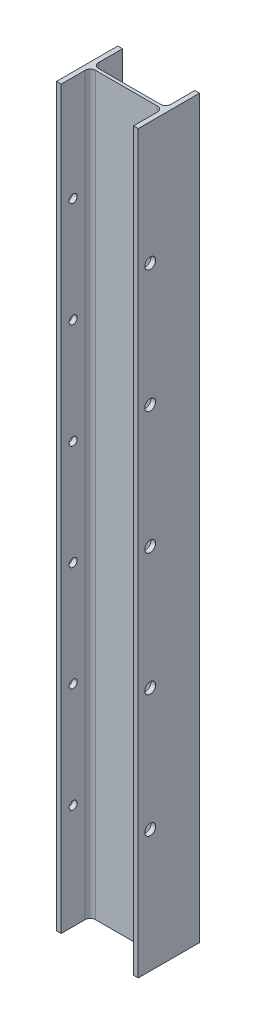
from build123d import *

# Parameters (mm, degrees)
AL_I_BEAM_AL_I_BEAM_4X2_31_4_DEPTH = 914.4
F_3_8_CLEARANCE_HOLE1_REACH        = 476.511
F_3_8_CLEARANCE_HOLE1_BORE_R       = 5.0419
F_1_2_CLEARANCE_HOLE1_D            = 13.49248
F_1_2_CLEARANCE_HOLE1_DEPTH        = 5.842


with BuildPart() as part:
    # Sketch11 → Al i beam AL I BEAM 4X2.31(4) (new body)
    with BuildSketch(Plane(origin=(53.975, -457.2, -38.1), x_dir=(0, 0, -1), z_dir=(0, 1, 0))):
        with BuildLine():
            Line((-38.1, -50.8), (-38.1, -44.958))
            Line((-38.1, -44.958), (-8.255, -44.958))
            ThreePointArc((-8.255, -44.958), (-3.764871939, -43.098128061), (-1.905, -38.608))
            Line((-1.905, -38.608), (-1.905, 38.608))
            ThreePointArc((-1.905, 38.608), (-3.764871939, 43.098128061), (-8.255, 44.958))
            Line((-8.255, 44.958), (-38.1, 44.958))
            Line((-38.1, 44.958), (-38.1, 50.8))
            Line((-38.1, 50.8), (38.1, 50.8))
            Line((38.1, 50.8), (38.1, 44.958))
            Line((38.1, 44.958), (8.255, 44.958))
            ThreePointArc((8.255, 44.958), (3.764871939, 43.098128061), (1.905, 38.608))
            Line((1.905, 38.608), (1.905, -38.608))
            ThreePointArc((1.905, -38.608), (3.764871939, -43.098128061), (8.255, -44.958))
            Line((8.255, -44.958), (38.1, -44.958))
            Line((38.1, -44.958), (38.1, -50.8))
            Line((38.1, -50.8), (-38.1, -50.8))
        make_face()
    extrude(amount=AL_I_BEAM_AL_I_BEAM_4X2_31_4_DEPTH)

    # 3/8 Clearance Hole1 bore → 3/8 Clearance Hole1 (cut, up to next)
    with BuildSketch(Plane(origin=(3.175, 0, 0), x_dir=(0, 0, -1), z_dir=(-1, 0, 0)), mode=Mode.PRIVATE) as f_3_8_clearance_hole1_sk1:
        with Locations((14.9225, -326.571428209)):
            Circle(F_3_8_CLEARANCE_HOLE1_BORE_R)
    f_3_8_clearance_hole1_tool1 = extrude(f_3_8_clearance_hole1_sk1.sketch, amount=-F_3_8_CLEARANCE_HOLE1_REACH, mode=Mode.PRIVATE) & part.part
    # 3/8 Clearance Hole1 bore → 3/8 Clearance Hole1 (cut, up to next)
    with BuildSketch(Plane(origin=(3.175, 0, 0), x_dir=(0, 0, -1), z_dir=(-1, 0, 0)), mode=Mode.PRIVATE) as f_3_8_clearance_hole1_sk2:
        with Locations((14.9225, 326.571428571)):
            Circle(F_3_8_CLEARANCE_HOLE1_BORE_R)
    f_3_8_clearance_hole1_tool2 = extrude(f_3_8_clearance_hole1_sk2.sketch, amount=-F_3_8_CLEARANCE_HOLE1_REACH, mode=Mode.PRIVATE) & part.part
    # 3/8 Clearance Hole1 bore → 3/8 Clearance Hole1 (cut, up to next)
    with BuildSketch(Plane(origin=(3.175, 0, 0), x_dir=(0, 0, -1), z_dir=(-1, 0, 0)), mode=Mode.PRIVATE) as f_3_8_clearance_hole1_sk3:
        with Locations((14.9225, 195.942857215)):
            Circle(F_3_8_CLEARANCE_HOLE1_BORE_R)
    f_3_8_clearance_hole1_tool3 = extrude(f_3_8_clearance_hole1_sk3.sketch, amount=-F_3_8_CLEARANCE_HOLE1_REACH, mode=Mode.PRIVATE) & part.part
    # 3/8 Clearance Hole1 bore → 3/8 Clearance Hole1 (cut, up to next)
    with BuildSketch(Plane(origin=(3.175, 0, 0), x_dir=(0, 0, -1), z_dir=(-1, 0, 0)), mode=Mode.PRIVATE) as f_3_8_clearance_hole1_sk4:
        with Locations((14.9225, 65.314285859)):
            Circle(F_3_8_CLEARANCE_HOLE1_BORE_R)
    f_3_8_clearance_hole1_tool4 = extrude(f_3_8_clearance_hole1_sk4.sketch, amount=-F_3_8_CLEARANCE_HOLE1_REACH, mode=Mode.PRIVATE) & part.part
    # 3/8 Clearance Hole1 bore → 3/8 Clearance Hole1 (cut, up to next)
    with BuildSketch(Plane(origin=(3.175, 0, 0), x_dir=(0, 0, -1), z_dir=(-1, 0, 0)), mode=Mode.PRIVATE) as f_3_8_clearance_hole1_sk5:
        with Locations((14.9225, -65.314285497)):
            Circle(F_3_8_CLEARANCE_HOLE1_BORE_R)
    f_3_8_clearance_hole1_tool5 = extrude(f_3_8_clearance_hole1_sk5.sketch, amount=-F_3_8_CLEARANCE_HOLE1_REACH, mode=Mode.PRIVATE) & part.part
    # 3/8 Clearance Hole1 bore → 3/8 Clearance Hole1 (cut, up to next)
    with BuildSketch(Plane(origin=(3.175, 0, 0), x_dir=(0, 0, -1), z_dir=(-1, 0, 0)), mode=Mode.PRIVATE) as f_3_8_clearance_hole1_sk6:
        with Locations((14.9225, -195.942856853)):
            Circle(F_3_8_CLEARANCE_HOLE1_BORE_R)
    f_3_8_clearance_hole1_tool6 = extrude(f_3_8_clearance_hole1_sk6.sketch, amount=-F_3_8_CLEARANCE_HOLE1_REACH, mode=Mode.PRIVATE) & part.part
    add(f_3_8_clearance_hole1_tool1.solids().sort_by_distance((3.175, 326.571428, -14.9225))[0], mode=Mode.SUBTRACT)
    add(f_3_8_clearance_hole1_tool2.solids().sort_by_distance((3.175, -326.571429, -14.9225))[0], mode=Mode.SUBTRACT)
    add(f_3_8_clearance_hole1_tool3.solids().sort_by_distance((3.175, -195.942857, -14.9225))[0], mode=Mode.SUBTRACT)
    add(f_3_8_clearance_hole1_tool4.solids().sort_by_distance((3.175, -65.314286, -14.9225))[0], mode=Mode.SUBTRACT)
    add(f_3_8_clearance_hole1_tool5.solids().sort_by_distance((3.175, 65.314285, -14.9225))[0], mode=Mode.SUBTRACT)
    add(f_3_8_clearance_hole1_tool6.solids().sort_by_distance((3.175, 195.942857, -14.9225))[0], mode=Mode.SUBTRACT)

    # 1/2 Clearance Hole1
    with Locations(Plane.ZY.offset(-98.933)):
        with Locations((-14.9225, 304.8), (-14.9225, -304.8), (-14.9225, -152.4), (-14.9225, 0), (-14.9225, 152.4)):
            Hole(F_1_2_CLEARANCE_HOLE1_D / 2, depth=F_1_2_CLEARANCE_HOLE1_DEPTH)


solid = part.part
